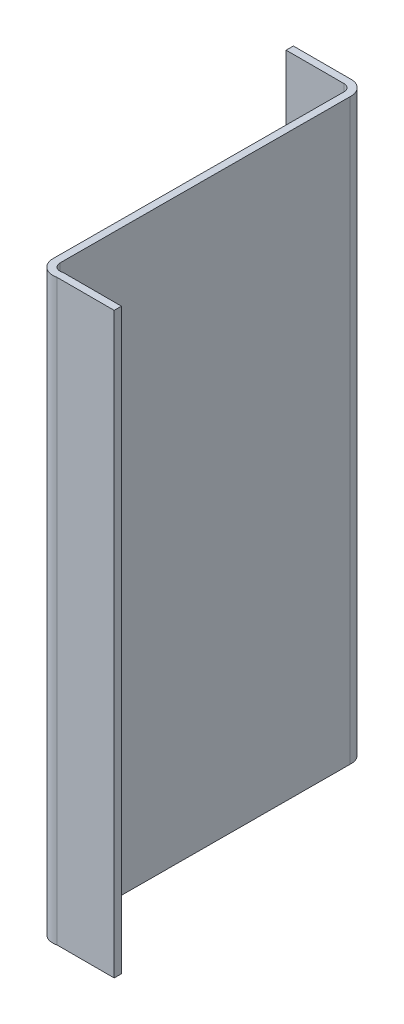
from build123d import *

# Parameters (mm, degrees)
EXTRUDE_THIN1_DEPTH = 400


with BuildPart() as part:
    # Sketch1 → Extrude-Thin1 (new body)
    with BuildSketch(Plane(origin=(0, 0, 0), x_dir=(1, 0, 0), z_dir=(0, 1, 0))):
        with BuildLine():
            Line((-46.726101212, 151.113189738), (-6.724981576, 151.113189738))
            ThreePointArc((-6.724981576, 151.113189738), (-3.011728055, 149.461688161), (-1.751349164, 145.598120611))
            Line((-1.751349164, 145.598120611), (-2.499982506, -54.513654379))
            ThreePointArc((-2.499982506, -54.513654379), (1.362139111, -62.445932955), (10.001711114, -64.233339564))
            Line((10.001711114, -64.233339564), (49.661853535, -64.233339564))
            Line((49.661853535, -64.233339564), (49.661853535, -59.233339564))
            Line((49.661853535, -59.233339564), (9.254697404, -59.233339564))
            ThreePointArc((9.254697404, -59.233339564), (4.6438767, -58.655180628), (2.499982506, -54.532359627))
            Line((2.499982506, -54.532359627), (3.247845267, 145.373437083))
            ThreePointArc((3.247845267, 145.373437083), (0.603039342, 152.9177067), (-6.724981576, 156.113189738))
            Line((-6.724981576, 156.113189738), (-46.726101212, 156.113189738))
            Line((-46.726101212, 156.113189738), (-46.726101212, 151.113189738))
        make_face()
    extrude(amount=EXTRUDE_THIN1_DEPTH)


solid = part.part
